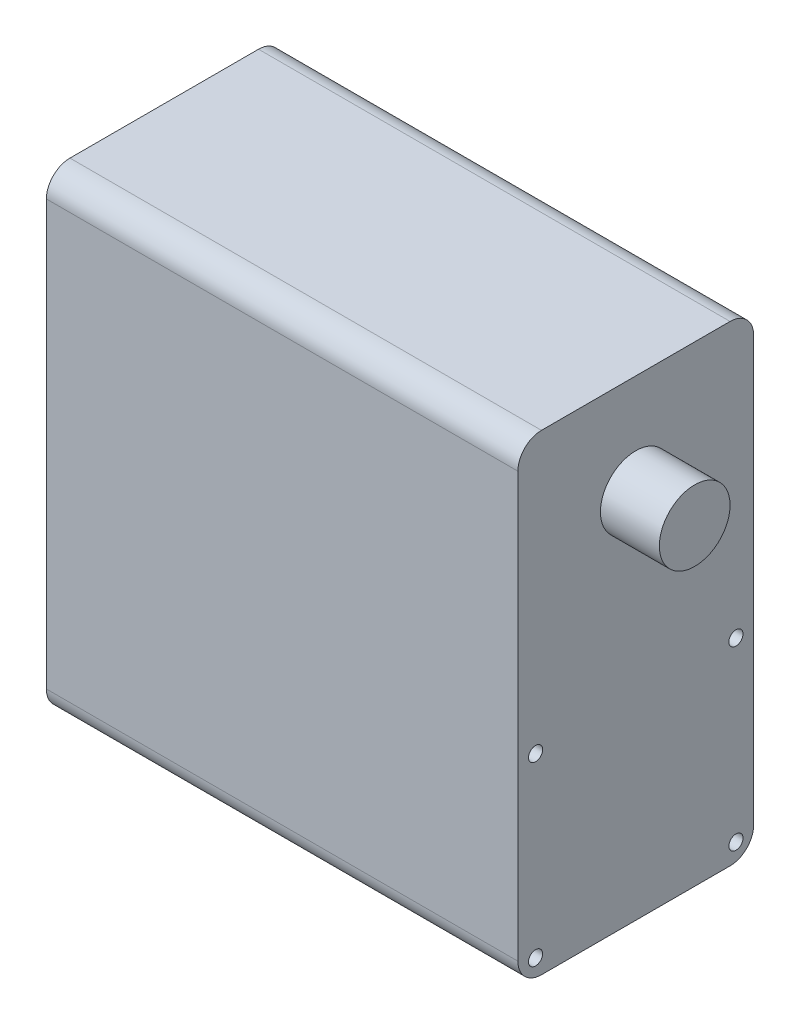
from build123d import *

# Parameters (mm, degrees)
SKETCH_1_W           = 20
SKETCH_1_H           = 40
EXTRUDE_1_DEPTH      = 40
SKETCH_2_R           = 0.6
CUT_EXTRUDE_1_DEPTH  = 5
EXTRUDE_3_DEPTH      = 5
EXTRUDE_3_DEPTH_BACK = 45
SKETCH_3_R           = 3
SKETCH_4_R           = 1
CUT_EXTRUDE_2_DEPTH  = 5
FILLET_1_R           = 2


with BuildPart() as part:
    # ｽｹｯﾁ1 → ﾎﾞｽ - 押し出し1 (new body)
    with BuildSketch(Plane(origin=(0, 0, 0), x_dir=(0, 0, -1), z_dir=(1, 0, 0))):
        with Locations((18.409001804, -0.200935369)):
            Rectangle(SKETCH_1_W, SKETCH_1_H)
    extrude(amount=EXTRUDE_1_DEPTH)

    # ｽｹｯﾁ2 → ｶｯﾄ - 押し出し1 (cut)
    with BuildSketch(Plane(origin=(40, 0, 0), x_dir=(0, 0, -1), z_dir=(1, 0, 0))):
        with Locations((26.909001804, -18.700935369)):
            Circle(SKETCH_2_R)
        with Locations((26.909001804, -3.700935369)):
            Circle(SKETCH_2_R)
        with Locations(Location((9.909001804, -3.700935369, 0), (0, 0, 180))):
            Circle(SKETCH_2_R)
        with Locations(Location((9.909001804, -18.700935369, 0), (0, 0, 180))):
            Circle(SKETCH_2_R)
    extrude(amount=-CUT_EXTRUDE_1_DEPTH, mode=Mode.SUBTRACT)

    # ｽｹｯﾁ3 → ﾎﾞｽ - 押し出し3 (add, two sides: drawn at the far end of the back side and taken through both)
    with BuildSketch(Plane(origin=(40, 0, 0), x_dir=(0, 0, -1), z_dir=(1, 0, 0)).offset(-EXTRUDE_3_DEPTH_BACK)):
        with Locations((18.409001804, 11.299064631)):
            Circle(SKETCH_3_R)
    extrude(amount=EXTRUDE_3_DEPTH + EXTRUDE_3_DEPTH_BACK)

    # ｽｹｯﾁ4 → ｶｯﾄ - 押し出し2 (cut)
    with BuildSketch(Plane.ZY):
        with Locations((-11.409001804, -13.700935369)):
            Circle(SKETCH_4_R)
        with Locations((-25.409001804, -13.700935369)):
            Circle(SKETCH_4_R)
        with Locations(Location((-26.409001804, 2.299064631, 0), (0, 0, 180))):
            Circle(SKETCH_4_R)
        with Locations((-10.409001804, 2.299064631)):
            Circle(SKETCH_4_R)
        with Locations((-11.409001804, -10.700935369)):
            Circle(SKETCH_4_R)
        with Locations(Location((-25.409001804, -10.700935369, 0), (0, 0, 180))):
            Circle(SKETCH_4_R)
        with Locations((-18.409001804, -17.200935369)):
            Circle(SKETCH_4_R)
    extrude(amount=-CUT_EXTRUDE_2_DEPTH, mode=Mode.SUBTRACT)

    # ﾌｨﾚｯﾄ1
    fillet_1_edges = [part.edges().sort_by_distance(p)[0] for p in [
        (20, 19.799064631, -8.409001804),
        (20, 19.799064631, -28.409001804),
        (20, -20.200935369, -28.409001804),
        (20, -20.200935369, -8.409001804),
    ]]
    fillet(fillet_1_edges, radius=FILLET_1_R)


solid = part.part
